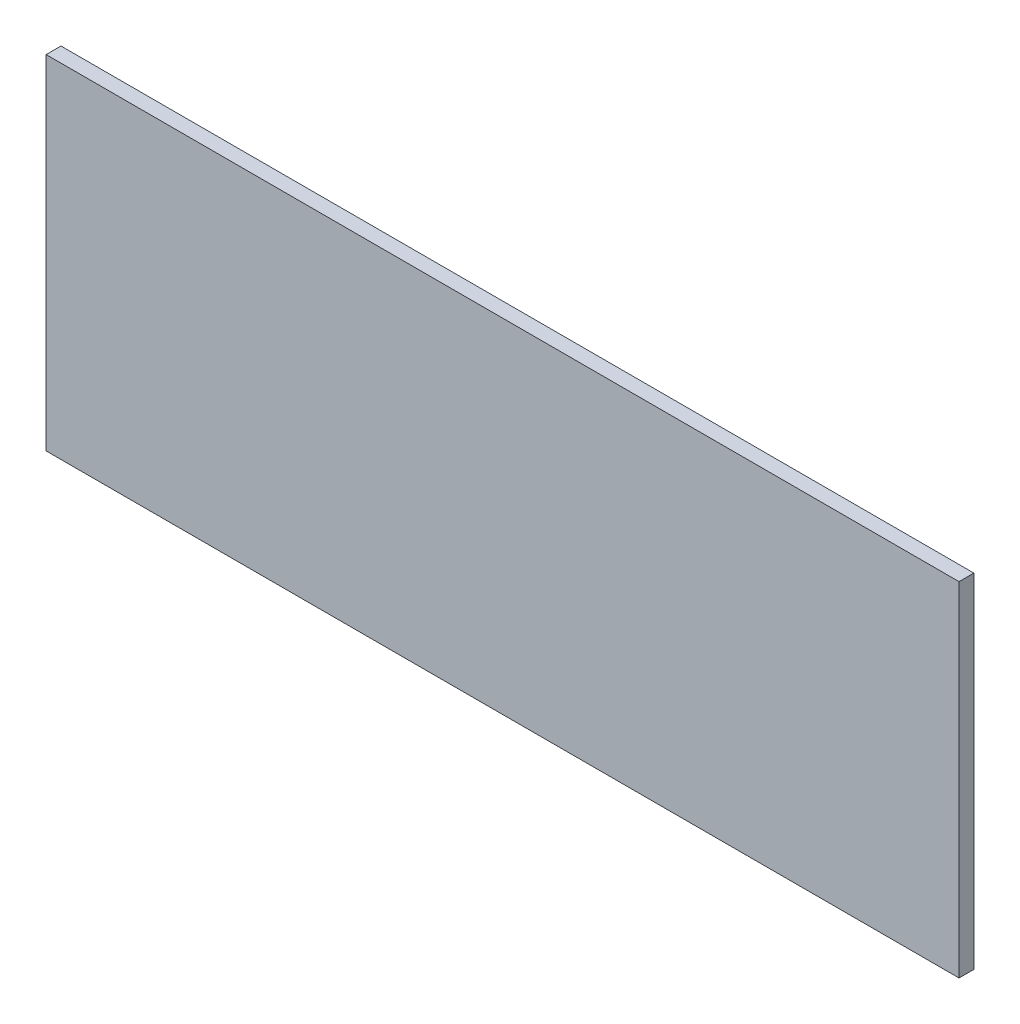
from build123d import *

# Parameters (mm, degrees)
ESQUISSE1_W        = 492
ESQUISSE1_H        = 185
BOSS_EXTRU_1_DEPTH = 8


with BuildPart() as part:
    # Esquisse1 → Boss.-Extru.1 (new body)
    with BuildSketch(Plane.XY):
        with Locations((175.892412385, 68.175947867)):
            Rectangle(ESQUISSE1_W, ESQUISSE1_H)
    extrude(amount=BOSS_EXTRU_1_DEPTH)


solid = part.part
